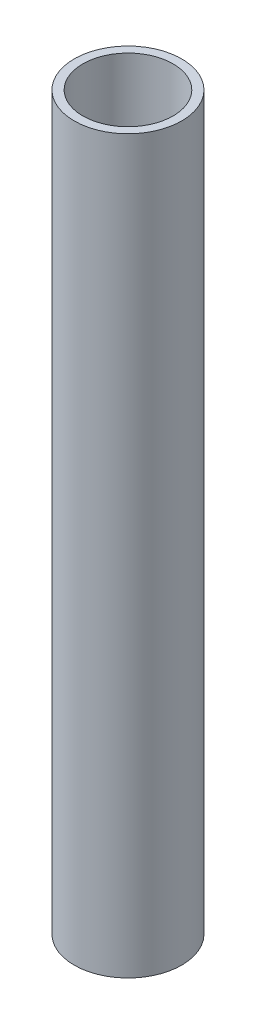
from build123d import *

# Parameters (mm, degrees)
CROQUIS1_R              = 12.5
CROQUIS1_R_2            = 10.5
SALIENTE_EXTRUIR1_DEPTH = 170


with BuildPart() as part:
    # Croquis1 → Saliente-Extruir1 (new body)
    with BuildSketch(Plane(origin=(0, 0, 0), x_dir=(1, 0, 0), z_dir=(0, 1, 0))):
        with Locations(Location((0, 0, 0), (0, 0, 270))):
            Circle(CROQUIS1_R)
        with Locations(Location((0, 0, 0), (0, 0, 270))):
            Circle(CROQUIS1_R_2, mode=Mode.SUBTRACT)
    extrude(amount=SALIENTE_EXTRUIR1_DEPTH)


solid = part.part
